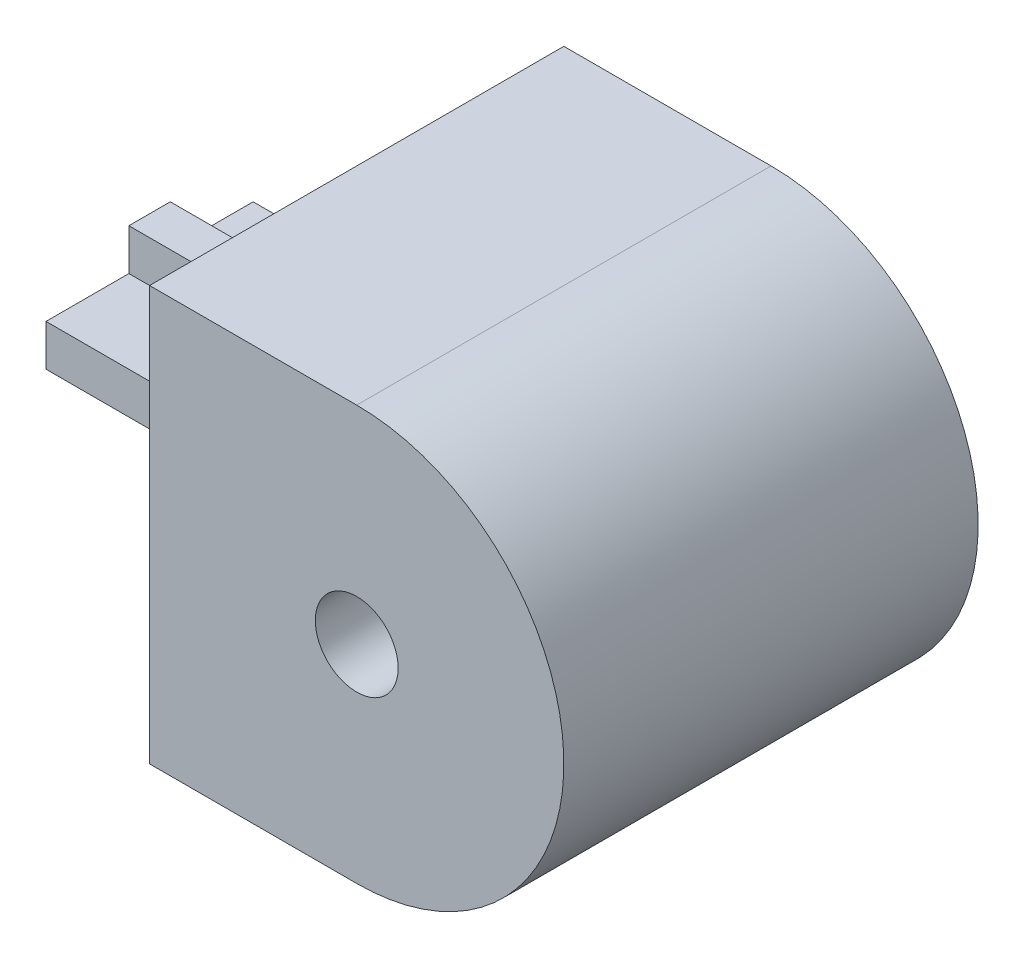
from build123d import *

# Parameters (mm, degrees)
BOSS_EXTRUDE1_DEPTH = 5
SKETCH2_R           = 0.5
CUT_EXTRUDE1_DEPTH  = 9.660254038
BOSS_EXTRUDE2_DEPTH = 2.5


with BuildPart() as part:
    # Sketch1 → Boss-Extrude1 (new body)
    with BuildSketch(Plane.XY):
        with BuildLine():
            Line((0, 5), (2.5, 5))
            ThreePointArc((2.5, 5), (5, 2.5), (2.5, 0))
            Line((2.5, 0), (0, 0))
            Line((0, 0), (0, 5))
        make_face()
    extrude(amount=BOSS_EXTRUDE1_DEPTH)

    # Sketch2 → Cut-Extrude1 (cut, through all)
    with BuildSketch(Plane.XY):
        with Locations((2.5, 2.5)):
            Circle(SKETCH2_R)
    extrude(amount=CUT_EXTRUDE1_DEPTH, mode=Mode.SUBTRACT)

    # Sketch4 → Boss-Extrude2 (add)
    with BuildSketch(Plane.ZY):
        Polygon((2.25, 2.75), (2.25, 3.25), (2.75, 3.25), (2.75, 2.75), (3.75, 2.75), (3.75, 2.25), (2.75, 2.25), (2.75, 1.75), (2.25, 1.75), (2.25, 2.25), (1.25, 2.25), (1.25, 2.75), align=None)
    extrude(amount=BOSS_EXTRUDE2_DEPTH)


solid = part.part
